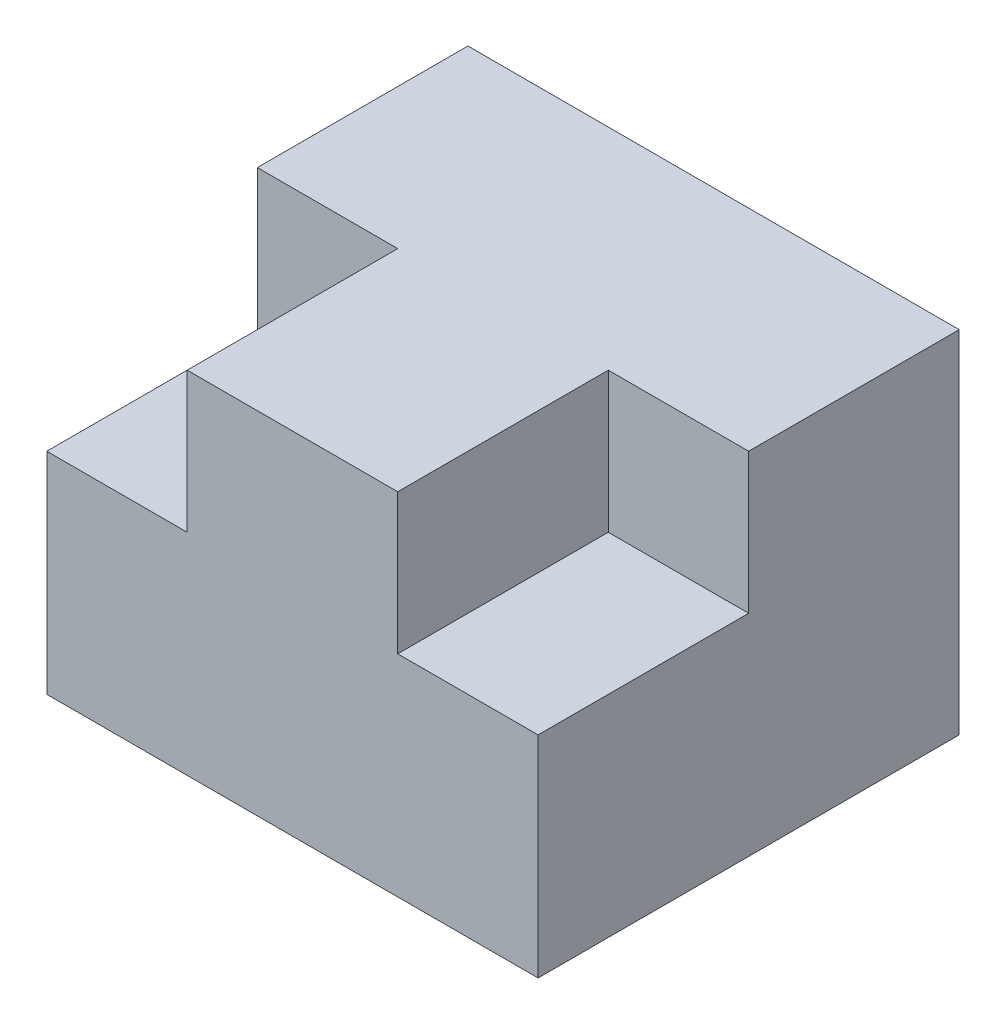
from build123d import *

# Parameters (mm, degrees)
BOSS_EXTRUDE2_DEPTH = 15
SKETCH1_7_W         = 35
SKETCH1_7_H         = 25
BOSS_EXTRUDE3_DEPTH = 15


with BuildPart() as part:
    # Sketch1 → Boss-Extrude2 (new body)
    with BuildSketch(Plane.XY):
        Polygon((0, 15), (0, 0), (35, 0), (35, 15), (25, 15), (25, 25), (10, 25), (10, 15), align=None)
    extrude(amount=BOSS_EXTRUDE2_DEPTH)

    # Sketch1<7> → Boss-Extrude3 (add)
    with BuildSketch(Plane.XY):
        with Locations((17.5, 12.5)):
            Rectangle(SKETCH1_7_W, SKETCH1_7_H)
    extrude(amount=-BOSS_EXTRUDE3_DEPTH)


solid = part.part
